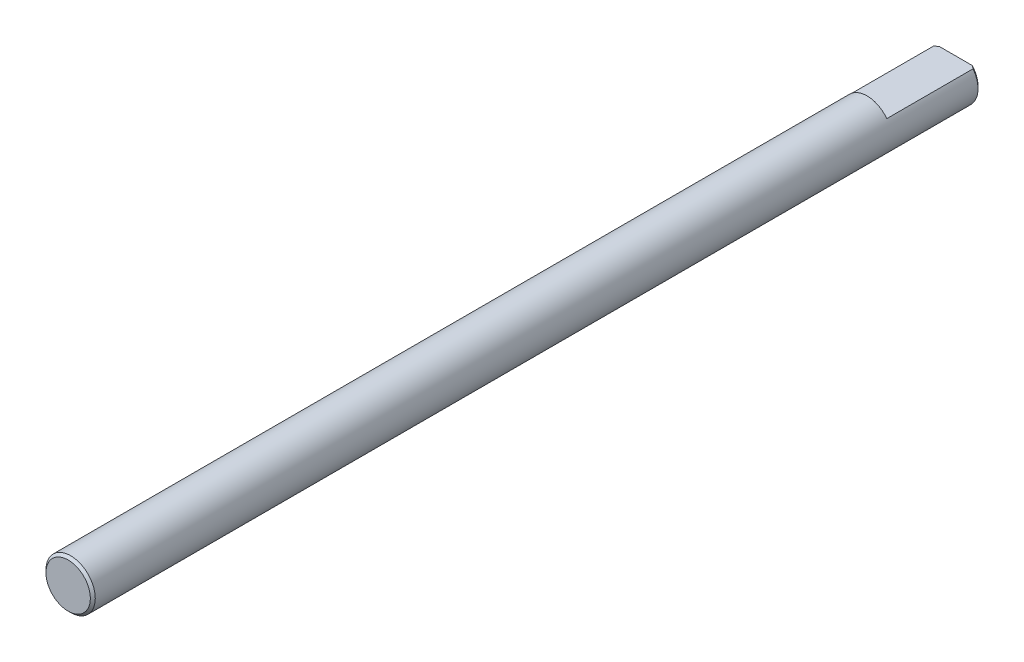
from build123d import *

# Parameters (mm, degrees)
SKETCH1_R           = 2.5
BOSS_EXTRUDE1_DEPTH = 90
CHAMFER1_SIZE       = 0.25
CUT_EXTRUDE1_START  = -9
CUT_EXTRUDE1_DEPTH  = 9


with BuildPart() as part:
    # Sketch1 → Boss-Extrude1 (new body)
    with BuildSketch(Plane.XY):
        Circle(SKETCH1_R)
    extrude(amount=-BOSS_EXTRUDE1_DEPTH)

    # Chamfer1
    chamfer1_edges = [part.edges().sort_by_distance(p)[0] for p in [
        (-2.5, 0, 0),
        (-2.5, 0, -90),
    ]]
    chamfer(chamfer1_edges, length=CHAMFER1_SIZE)

    # Sketch2 → Cut-Extrude1 (cut)
    with BuildSketch(Plane(origin=(0, 0, -90), x_dir=(-1, 0, 0), z_dir=(0, 0, -1)).offset(CUT_EXTRUDE1_START)):
        with BuildLine():
            Line((-2, 1.5), (2, 1.5))
            ThreePointArc((2, 1.5), (0, 2.5), (-2, 1.5))
        make_face()
    extrude(amount=CUT_EXTRUDE1_DEPTH, mode=Mode.SUBTRACT)


solid = part.part
